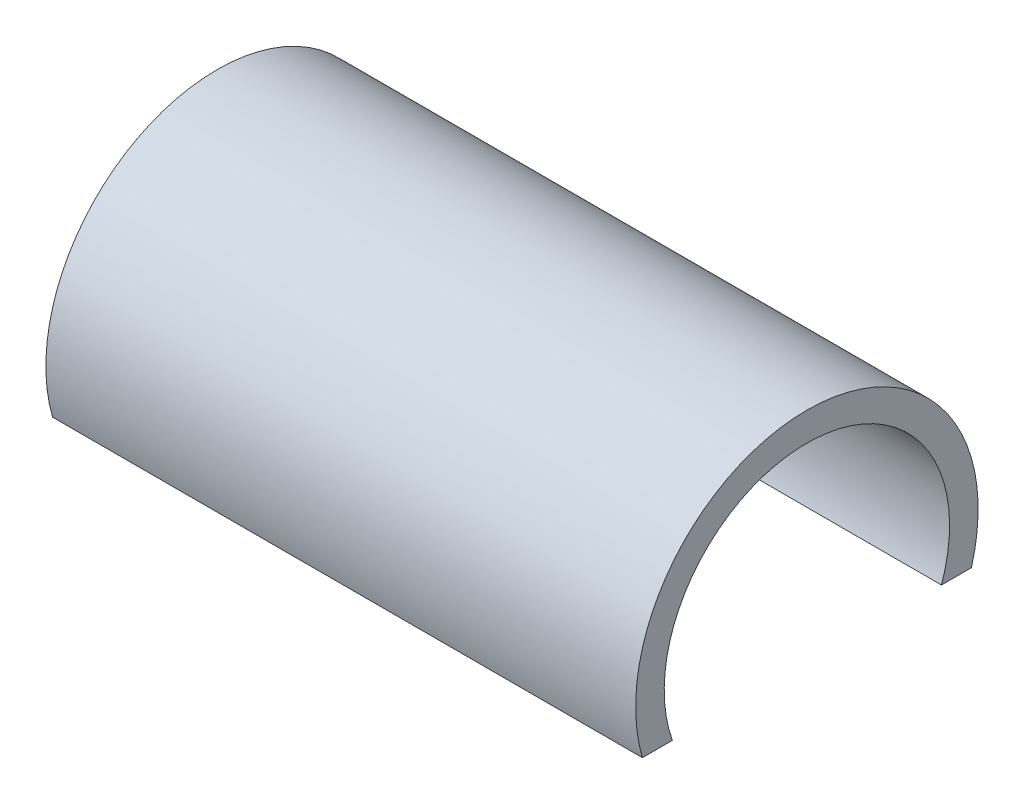
from build123d import *

# Parameters (mm, degrees)
ESBO_O2_R                = 15
RESSALTO_EXTRUS_O1_DEPTH = 62
CASCA1_T                 = 3
CORTE_EXTRUS_O2_DEPTH    = 68.02238432


with BuildPart() as part:
    # Esboço2 → Ressalto-extrusão1 (new body)
    with BuildSketch(Plane(origin=(35, 0, 0), x_dir=(0, 0, -1), z_dir=(1, 0, 0))):
        Circle(ESBO_O2_R)
    extrude(amount=-RESSALTO_EXTRUS_O1_DEPTH)

    # Casca1
    casca1_openings = [part.faces().sort_by_distance(p)[0] for p in [
        (35, 0, 0),
        (-27, 0, 0),
    ]]
    offset(amount=CASCA1_T, openings=casca1_openings, kind=Kind.INTERSECTION)

    # Esboço3 → Corte-extrusão2 (cut, through all)
    with BuildSketch(Plane(origin=(35, 0, 0), x_dir=(0, 0, -1), z_dir=(1, 0, 0))):
        with BuildLine():
            Line((-17.2933099, -4.994139836), (17.2933099, -4.994139836))
            ThreePointArc((17.2933099, -4.994139836), (0, -18), (-17.2933099, -4.994139836))
        make_face()
    extrude(amount=-CORTE_EXTRUS_O2_DEPTH, mode=Mode.SUBTRACT)


solid = part.part
